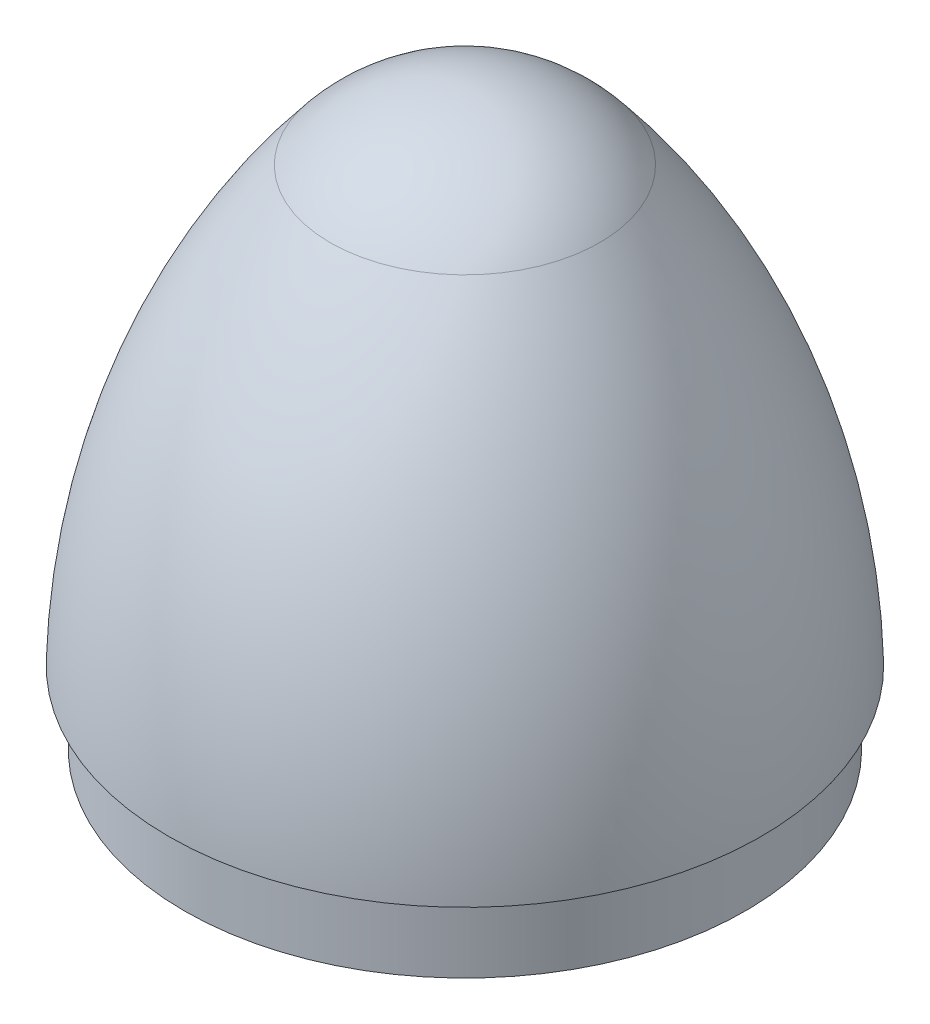
from build123d import *


with BuildPart() as part:
    # Sketch1 → Revolve1 (revolve)
    with BuildSketch(Plane.XY, mode=Mode.PRIVATE) as revolve1_sk:
        with BuildLine():
            Line((36, 0), (36, 9.273527401))
            Line((36, 9.273527401), (38, 9.273527401))
            ThreePointArc((38, 9.273527401), (32.292808279, 38.828283687), (17.301359595, 64.930239991))
            ThreePointArc((17.301359595, 64.930239991), (9.570558854, 70.962732086), (0, 73.098298569))
            Line((0, 73.098298569), (0, 70.502625536))
            ThreePointArc((0, 70.502625536), (8.683206256, 68.457919009), (15.556078936, 62.770870849))
            ThreePointArc((15.556078936, 62.770870849), (28.90895132, 38.760916956), (35, 11.971437438))
            Line((35, 11.971437438), (33, 11.971437438))
            Line((33, 11.971437438), (33, 0))
            Line((33, 0), (36, 0))
        make_face()
    revolve(revolve1_sk.sketch.rotate(Axis((0, 85.69389694, 0), (0, -1, 0)), 90), axis=Axis((0, 85.69389694, 0), (0, -1, 0)))


solid = part.part
